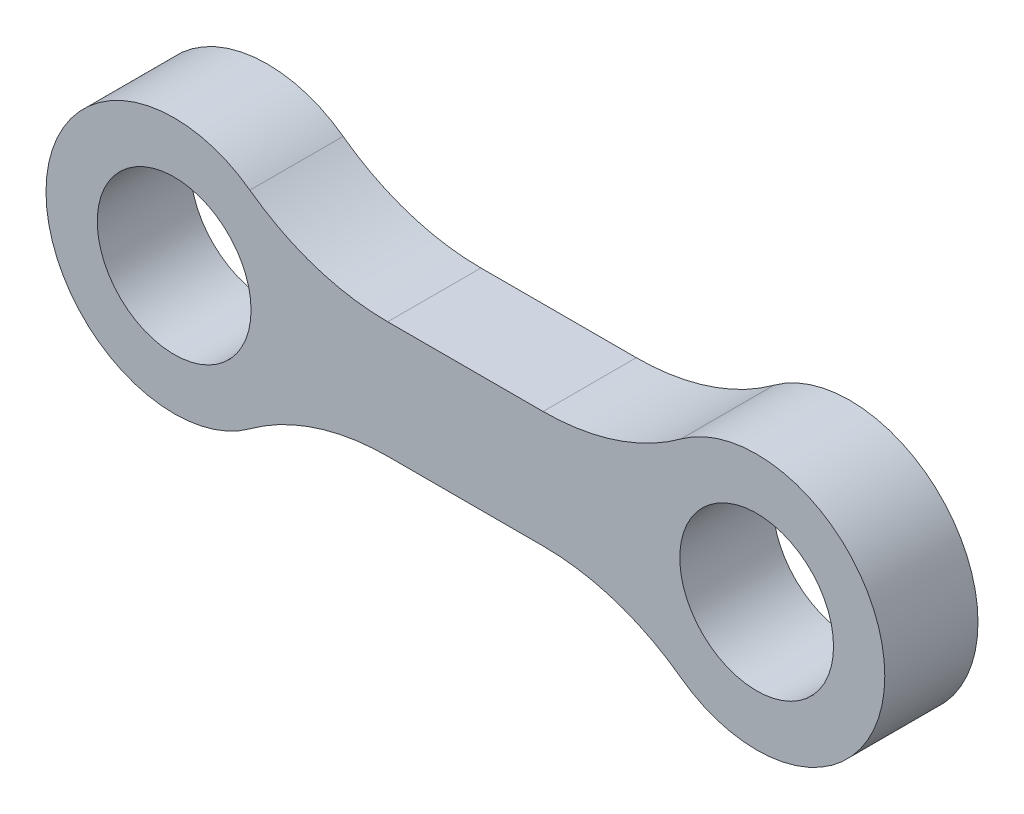
from build123d import *

# Parameters (mm, degrees)
EXTRUDE_1_DEPTH = 4
FILLET_1_R      = 10


with BuildPart() as part:
    # ｽｹｯﾁ1 → ﾎﾞｽ - 押し出し1 (new body)
    with BuildSketch(Plane.XY):
        with BuildLine():
            Line((-0.345934077, 5), (0, 5))
            Line((0, 5), (0, 4.654065923))
            ThreePointArc((0, 4.654065923), (0.59354166, 3.648912529), (0.8, 2.5))
            ThreePointArc((0.8, 2.5), (0.59354166, 1.351087471), (0, 0.345934077))
            Line((0, 0.345934077), (0, 0))
            Line((0, 0), (-0.345934077, 0))
            ThreePointArc((-0.345934077, 0), (-2.5, -0.8), (-4.654065923, 0))
            Line((-4.654065923, 0), (-7.398979486, 0))
            ThreePointArc((-7.398979486, 0), (-1.214384811, -2.847634392), (3, 2.5))
            ThreePointArc((3, 2.5), (-1.214384811, 7.847634392), (-7.398979486, 5))
            Line((-7.398979486, 5), (-4.654065923, 5))
            ThreePointArc((-4.654065923, 5), (-2.5, 5.8), (-0.345934077, 5))
        make_face()
        with BuildLine():
            ThreePointArc((-4.654065923, 0), (-5.8, 2.5), (-4.654065923, 5))
            Line((-4.654065923, 5), (-7.398979486, 5))
            ThreePointArc((-7.398979486, 5), (-8, 2.5), (-7.398979486, 0))
            Line((-7.398979486, 0), (-4.654065923, 0))
        make_face()
        with BuildLine():
            Line((0, 0), (0, 0.345934077))
            ThreePointArc((0, 0.345934077), (-0.166547622, 0.166547622), (-0.345934077, 0))
            Line((-0.345934077, 0), (0, 0))
        make_face()
        with BuildLine():
            Line((0, 4.654065923), (0, 5))
            Line((0, 5), (-0.345934077, 5))
            ThreePointArc((-0.345934077, 5), (-0.166547622, 4.833452378), (0, 4.654065923))
        make_face()
        with BuildLine():
            ThreePointArc((-7.398979486, 0), (-8, 2.5), (-7.398979486, 5))
            Line((-7.398979486, 5), (-22.601020514, 5))
            ThreePointArc((-22.601020514, 5), (-22.152365608, 3.785615189), (-22, 2.5))
            ThreePointArc((-22, 2.5), (-22.152365608, 1.214384811), (-22.601020514, 0))
            Line((-22.601020514, 0), (-7.398979486, 0))
        make_face()
        with BuildLine():
            ThreePointArc((-22, 2.5), (-22.152365608, 3.785615189), (-22.601020514, 5))
            Line((-22.601020514, 5), (-25.345934077, 5))
            ThreePointArc((-25.345934077, 5), (-24.500131874, 3.875060445), (-24.2, 2.5))
            ThreePointArc((-24.2, 2.5), (-24.500131874, 1.124939555), (-25.345934077, 0))
            Line((-25.345934077, 0), (-22.601020514, 0))
            ThreePointArc((-22.601020514, 0), (-22.152365608, 1.214384811), (-22, 2.5))
        make_face()
        with BuildLine():
            Line((-25.345934077, 5), (-22.601020514, 5))
            ThreePointArc((-22.601020514, 5), (-33, 2.5), (-22.601020514, 0))
            Line((-22.601020514, 0), (-25.345934077, 0))
            ThreePointArc((-25.345934077, 0), (-27.5, -0.8), (-29.654065923, 0))
            Line((-29.654065923, 0), (-30, 0))
            Line((-30, 0), (-30, 0.345934077))
            ThreePointArc((-30, 0.345934077), (-30.8, 2.5), (-30, 4.654065923))
            Line((-30, 4.654065923), (-30, 5))
            Line((-30, 5), (-29.654065923, 5))
            ThreePointArc((-29.654065923, 5), (-27.5, 5.8), (-25.345934077, 5))
        make_face()
        with BuildLine():
            ThreePointArc((-30, 4.654065923), (-29.833452378, 4.833452378), (-29.654065923, 5))
            Line((-29.654065923, 5), (-30, 5))
            Line((-30, 5), (-30, 4.654065923))
        make_face()
        with BuildLine():
            Line((-30, 0), (-29.654065923, 0))
            ThreePointArc((-29.654065923, 0), (-29.833452378, 0.166547622), (-30, 0.345934077))
            Line((-30, 0.345934077), (-30, 0))
        make_face()
    extrude(amount=-EXTRUDE_1_DEPTH)

    # ﾌｨﾚｯﾄ1
    fillet_1_edges = [part.edges().sort_by_distance(p)[0] for p in [
        (-7.398979486, 0, -2),
        (-22.601020514, 0, -2),
        (-22.601020514, 5, -2),
        (-7.398979486, 5, -2),
    ]]
    fillet(fillet_1_edges, radius=FILLET_1_R)


solid = part.part
